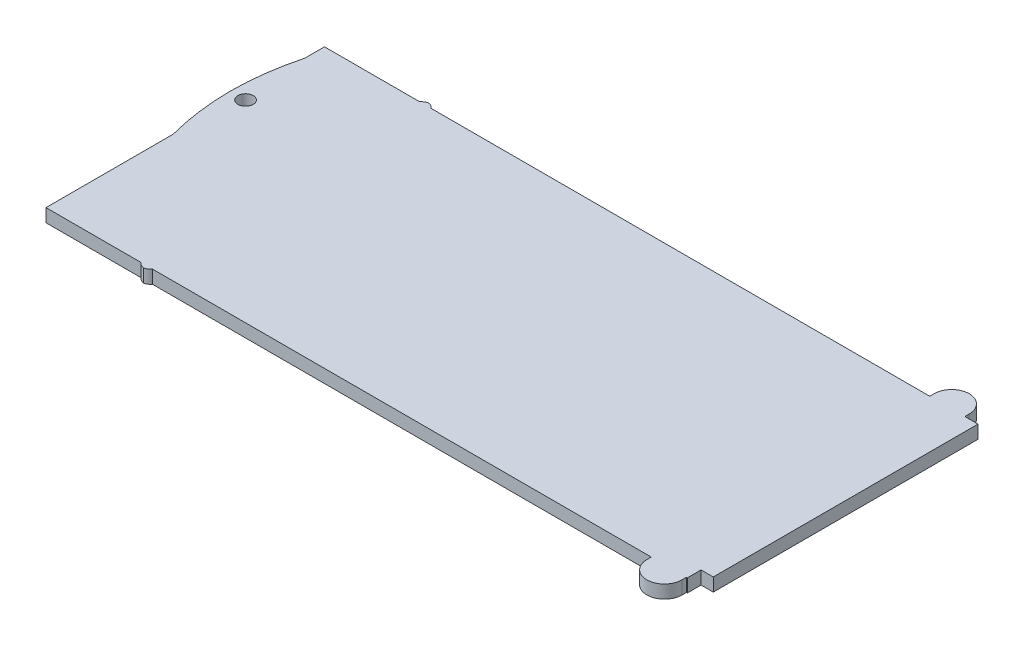
from build123d import *

# Parameters (mm, degrees)
CROQUIS1_R              = 1.750000001
SALIENTE_EXTRUIR1_DEPTH = 3


with BuildPart() as part:
    # Croquis1 → Saliente-Extruir1 (new body)
    with BuildSketch(Plane(origin=(0, 0, 0), x_dir=(1, 0, 0), z_dir=(0, 1, 0))):
        with BuildLine():
            Line((32.500000027, -77.500000065), (54.196483333, -77.500000065))
            ThreePointArc((54.196483333, -77.500000065), (54.770251601, -76.983361364), (55.496960614, -76.722555719))
            ThreePointArc((55.496960614, -76.722555719), (56.223669627, -76.983361364), (56.797437895, -77.500000065))
            Line((56.797437895, -77.500000065), (170.500000144, -77.500000065))
            Line((170.500000144, -77.500000065), (170.500000144, -76.500000065))
            ThreePointArc((170.500000144, -76.500000065), (174.500000147, -72.500000061), (178.500000151, -76.500000065))
            Line((178.500000151, -76.500000065), (178.500000151, -77.500000065))
            Line((178.500000151, -77.500000065), (181.500000153, -77.500000065))
            Line((181.500000153, -77.500000065), (181.500000153, -137.860356365))
            Line((181.500000153, -137.860356365), (178.718053625, -137.860356365))
            Line((178.718053625, -137.860356365), (178.718053625, -141.000000119))
            Line((178.718053625, -141.000000119), (178.500000151, -141.000000119))
            Line((178.500000151, -141.000000119), (178.500000151, -142.00000012))
            ThreePointArc((178.500000151, -142.00000012), (174.500000147, -146.000000123), (170.500000144, -142.00000012))
            Line((170.500000144, -142.00000012), (170.500000144, -141.000000119))
            Line((170.500000144, -141.000000119), (56.797437895, -141.000000119))
            ThreePointArc((56.797437895, -141.000000119), (56.223669627, -141.516638821), (55.496960614, -141.777444465))
            ThreePointArc((55.496960614, -141.777444465), (54.770251601, -141.516638821), (54.196483333, -141.000000119))
            Line((54.196483333, -141.000000119), (32.500000027, -141.000000119))
            Line((32.500000027, -141.000000119), (32.500000027, -112.000000094))
            ThreePointArc((32.500000027, -112.000000094), (31.025757989, -104.563270659), (30.501093828, -97.000000082))
            ThreePointArc((30.501093828, -97.000000082), (31.025757989, -89.436729506), (32.500000027, -82.000000069))
            Line((32.500000027, -82.000000069), (32.500000027, -77.500000065))
        make_face()
        with Locations(Location((34.000000029, -97.000000082, 0), (0, 0, 270))):
            Circle(CROQUIS1_R, mode=Mode.SUBTRACT)
    extrude(amount=SALIENTE_EXTRUIR1_DEPTH)


solid = part.part
